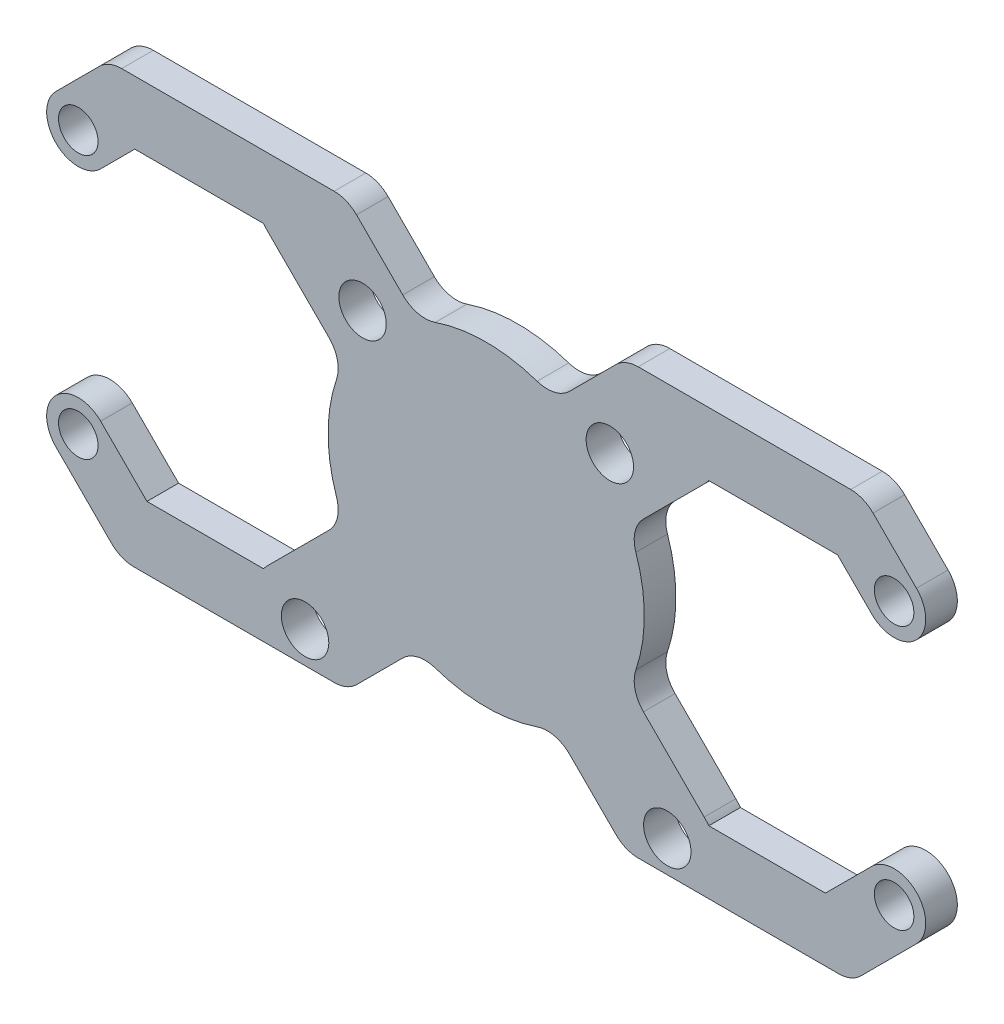
from build123d import *
from build123d.topology import SkipClean

# Parameters (mm, degrees)
SKETCH1_R           = 1.5
SKETCH1_R_2         = 1.25
BOSS_EXTRUDE1_DEPTH = 2
SKETCH2_W           = 50.695336344
SKETCH2_H           = 10.606019708
CUT_EXTRUDE1_DEPTH  = 40.656761755
CUT_EXTRUDE2_START  = -26.91026
SKETCH2_2_W         = 50.695336344
SKETCH2_2_H         = 10.606019708
CUT_EXTRUDE2_DEPTH  = 13.746501755
FILLET1_R           = 2


with BuildPart() as part:
    # Sketch1 → Boss-Extrude1 (new body)
    with BuildSketch(Plane.XY):
        with BuildLine():
            ThreePointArc((13.788582233, -49.138227177), (13.939896438, -48.976395169), (14.080010805, -48.804774799))
            Line((14.080010805, -48.804774799), (22.226347675, -48.804774799))
            Line((22.226347675, -48.804774799), (24.385786438, -50.964213562))
            ThreePointArc((24.385786438, -50.964213562), (27.214213562, -50.964213562), (27.214213562, -48.135786438))
            Line((27.214213562, -48.135786438), (24.468988362, -45.390561237))
            ThreePointArc((24.468988362, -45.390561237), (23.820141664, -44.957015734), (23.054774799, -44.804774799))
            Line((23.054774799, -44.804774799), (14.080010805, -44.804774799))
            ThreePointArc((14.080010805, -44.804774799), (11.676557666, -43.51221201), (9.121677477, -44.471322421))
            Line((9.121677477, -44.471322421), (5.27936576, -48.313634139))
            ThreePointArc((5.27936576, -48.313634139), (4.318629382, -48.847331879), (3.220960165, -48.792834589))
            ThreePointArc((3.220960165, -48.792834589), (0, -48.259904655), (-3.220960165, -48.792834589))
            ThreePointArc((-3.220960165, -48.792834589), (-4.318629382, -48.847331879), (-5.27936576, -48.313634139))
            Line((-5.27936576, -48.313634139), (-9.121677477, -44.471322421))
            ThreePointArc((-9.121677477, -44.471322421), (-11.676557666, -43.51221201), (-14.080010805, -44.804774799))
            Line((-14.080010805, -44.804774799), (-23.054774799, -44.804774799))
            ThreePointArc((-23.054774799, -44.804774799), (-23.820141664, -44.957015734), (-24.468988362, -45.390561237))
            Line((-24.468988362, -45.390561237), (-27.214213562, -48.135786438))
            ThreePointArc((-27.214213562, -48.135786438), (-27.214213562, -50.964213562), (-24.385786438, -50.964213562))
            Line((-24.385786438, -50.964213562), (-22.226347675, -48.804774799))
            Line((-22.226347675, -48.804774799), (-14.080010805, -48.804774799))
            ThreePointArc((-14.080010805, -48.804774799), (-13.939896438, -48.976395169), (-13.788582233, -49.138227177))
            Line((-13.788582233, -49.138227177), (-9.946270516, -52.980538895))
            ThreePointArc((-9.946270516, -52.980538895), (-9.412572775, -53.941275272), (-9.467070065, -55.03894449))
            ThreePointArc((-9.467070065, -55.03894449), (-10, -58.259904655), (-9.467070065, -61.480864819))
            ThreePointArc((-9.467070065, -61.480864819), (-9.412572775, -62.578534037), (-9.946270516, -63.539270415))
            Line((-9.946270516, -63.539270415), (-13.788582233, -67.381582132))
            ThreePointArc((-13.788582233, -67.381582132), (-13.939896438, -67.54341414), (-14.080010805, -67.71503451))
            Line((-14.080010805, -67.71503451), (-21.456538365, -67.71503451))
            Line((-21.456538365, -67.71503451), (-24.385786438, -64.785786438))
            ThreePointArc((-24.385786438, -64.785786438), (-27.214213562, -64.785786438), (-27.214213562, -67.614213562))
            Line((-27.214213562, -67.614213562), (-23.699179053, -71.129248072))
            ThreePointArc((-23.699179053, -71.129248072), (-23.050332355, -71.562793575), (-22.28496549, -71.71503451))
            Line((-22.28496549, -71.71503451), (-14.080010805, -71.71503451))
            ThreePointArc((-14.080010805, -71.71503451), (-11.676557666, -73.0075973), (-9.121677477, -72.048486888))
            Line((-9.121677477, -72.048486888), (-5.27936576, -68.20617517))
            ThreePointArc((-5.27936576, -68.20617517), (-4.318629382, -67.67247743), (-3.220960165, -67.72697472))
            ThreePointArc((-3.220960165, -67.72697472), (0, -68.259904655), (3.220960165, -67.72697472))
            ThreePointArc((3.220960165, -67.72697472), (4.318629382, -67.67247743), (5.27936576, -68.20617517))
            Line((5.27936576, -68.20617517), (9.121677477, -72.048486888))
            ThreePointArc((9.121677477, -72.048486888), (11.676557666, -73.0075973), (14.080010805, -71.71503451))
            Line((14.080010805, -71.71503451), (22.28496549, -71.71503451))
            ThreePointArc((22.28496549, -71.71503451), (23.050332355, -71.562793575), (23.699179053, -71.129248072))
            Line((23.699179053, -71.129248072), (27.214213562, -67.614213562))
            ThreePointArc((27.214213562, -67.614213562), (27.214213562, -64.785786438), (24.385786438, -64.785786438))
            Line((24.385786438, -64.785786438), (21.456538365, -67.71503451))
            Line((21.456538365, -67.71503451), (14.080010805, -67.71503451))
            ThreePointArc((14.080010805, -67.71503451), (13.939896438, -67.54341414), (13.788582233, -67.381582132))
            Line((13.788582233, -67.381582132), (9.946270516, -63.539270415))
            ThreePointArc((9.946270516, -63.539270415), (9.412572775, -62.578534037), (9.467070065, -61.480864819))
            ThreePointArc((9.467070065, -61.480864819), (10, -58.259904655), (9.467070065, -55.03894449))
            ThreePointArc((9.467070065, -55.03894449), (9.412572775, -53.941275272), (9.946270516, -52.980538895))
            Line((9.946270516, -52.980538895), (13.788582233, -49.138227177))
        make_face()
        with Locations((-7.820715031, -50.439189624)):
            Circle(SKETCH1_R, mode=Mode.SUBTRACT)
        with Locations((7.820715031, -50.439189624)):
            Circle(SKETCH1_R, mode=Mode.SUBTRACT)
        with Locations((25.8, -49.55)):
            Circle(SKETCH1_R_2, mode=Mode.SUBTRACT)
        with Locations((11.455129855, -69.71503451)):
            Circle(SKETCH1_R, mode=Mode.SUBTRACT)
        with Locations((-25.8, -49.55)):
            Circle(SKETCH1_R_2, mode=Mode.SUBTRACT)
        with Locations((25.8, -66.2)):
            Circle(SKETCH1_R_2, mode=Mode.SUBTRACT)
        with Locations((-11.455129855, -69.71503451)):
            Circle(SKETCH1_R, mode=Mode.SUBTRACT)
        with Locations((-25.8, -66.2)):
            Circle(SKETCH1_R_2, mode=Mode.SUBTRACT)
    extrude(amount=BOSS_EXTRUDE1_DEPTH)

    # Sketch2 → Cut-Extrude1 (cut, through all)
    with BuildSketch(Plane(origin=(0, -44.804774799, 0), x_dir=(1, 0, 0), z_dir=(0, 1, 0))):
        Rectangle(SKETCH2_W, SKETCH2_H)
    extrude(amount=CUT_EXTRUDE1_DEPTH, mode=Mode.SUBTRACT)

    # Sketch2<2> → Cut-Extrude2 (cut, through all)
    with SkipClean():  # the faces are left unmerged after this step: merging them gives an invalid solid
        with BuildSketch(Plane(origin=(0, -44.804774799, 0), x_dir=(1, 0, 0), z_dir=(0, 1, 0)).offset(CUT_EXTRUDE2_START)):
            Rectangle(SKETCH2_2_W, SKETCH2_2_H)
        extrude(amount=-CUT_EXTRUDE2_DEPTH, mode=Mode.SUBTRACT)

    # Fillet1
    fillet1_edges = [part.edges().sort_by_distance(p)[0] for p in [
        (-8.788225099, -44.804774799, 1),
        (8.788225099, -44.804774799, 1),
        (8.788225389, -71.715034799, 1),
        (-8.788225389, -71.715034799, 1),
    ]]
    fillet(fillet1_edges, radius=FILLET1_R)


solid = part.part
